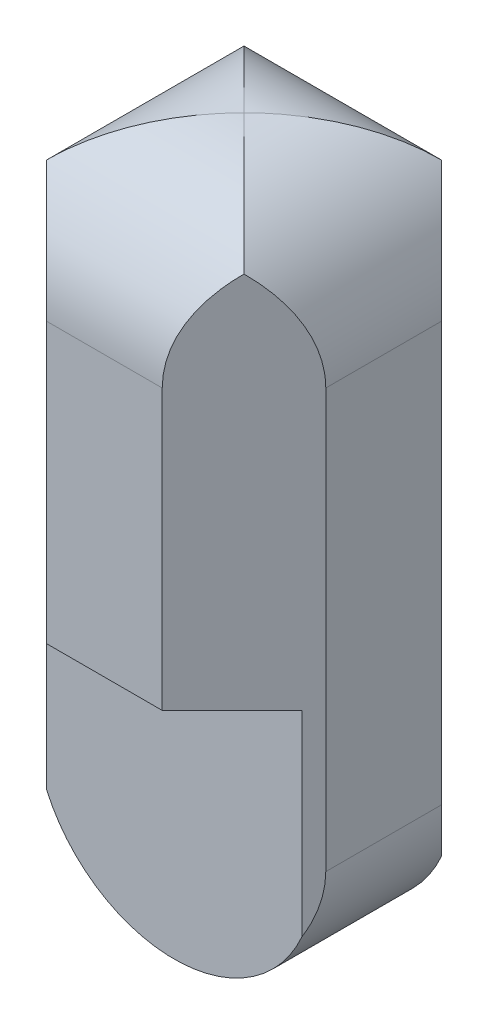
from build123d import *

# Parameters (mm, degrees)
EXTRUDE_1_DEPTH     = 50
CUT_EXTRUDE_1_DEPTH = 66
CUT_EXTRUDE_2_DEPTH = 5
CUT_EXTRUDE_START   = -5
CUT_EXTRUDE_3_DEPTH = 5
CUT_EXTRUDE_5_DEPTH = 30
CUT_EXTRUDE_6_DEPTH = 30


with BuildPart() as part:
    # 草图1 → 凸台-拉伸1 (new body)
    with BuildSketch(Plane(origin=(0, 0, 0), x_dir=(1, 0, 0), z_dir=(0, 1, 0))):
        Polygon((10, 4.142135624), (4.142135624, 10), (-4.142135624, 10), (-10, 4.142135624), (-10, -4.142135624), (-4.142135624, -10), (4.142135624, -10), (10, -4.142135624), align=None)
    extrude(amount=EXTRUDE_1_DEPTH)

    # 草图2 → 切除-拉伸1 (cut)
    with BuildSketch(Plane.XY.offset(10)):
        with BuildLine():
            Line((-10, 10), (-10, -2.389295552))
            Line((-10, -2.389295552), (10, -2.389295552))
            Line((10, -2.389295552), (10, 10))
            ThreePointArc((10, 10), (0, 0), (-10, 10))
        make_face()
    extrude(amount=-CUT_EXTRUDE_1_DEPTH, mode=Mode.SUBTRACT)

    # 草图4 → 切除-拉伸2 (cut)
    with BuildSketch(Plane.XY.offset(10)):
        with BuildLine():
            Line((-10, 10), (-10, 20))
            Line((-10, 20), (10, 20))
            Line((10, 20), (10, 10))
            ThreePointArc((10, 10), (0, 0), (-10, 10))
        make_face()
    extrude(amount=-CUT_EXTRUDE_2_DEPTH, mode=Mode.SUBTRACT)

    # 草图5 → 切除-拉伸3 (cut)
    with BuildSketch(Plane(origin=(0, 0, -10), x_dir=(-1, 0, 0), z_dir=(0, 0, -1)).offset(CUT_EXTRUDE_START)):
        with BuildLine():
            Line((-10, 10), (-10, 20))
            Line((-10, 20), (10, 20))
            Line((10, 20), (10, 10))
            ThreePointArc((10, 10), (0, 0), (-10, 10))
        make_face()
    extrude(amount=CUT_EXTRUDE_3_DEPTH, mode=Mode.SUBTRACT)

    # 草图7 → 切除-拉伸5 (cut)
    with BuildSketch(Plane.XY.offset(10)):
        with BuildLine():
            Line((-10, 40), (-10, 52.610016676))
            Line((-10, 52.610016676), (10, 52.610016676))
            Line((10, 52.610016676), (10, 40))
            ThreePointArc((10, 40), (0, 50), (-10, 40))
        make_face()
    extrude(amount=-CUT_EXTRUDE_5_DEPTH, mode=Mode.SUBTRACT)

    # 草图8 → 切除-拉伸6 (cut)
    with BuildSketch(Plane(origin=(10, 0, 0), x_dir=(0, 0, -1), z_dir=(1, 0, 0))):
        with BuildLine():
            Line((-10, 40), (-10, 54.562321687))
            Line((-10, 54.562321687), (10, 54.562321687))
            Line((10, 54.562321687), (10, 40))
            ThreePointArc((10, 40), (0, 50), (-10, 40))
        make_face()
    extrude(amount=-CUT_EXTRUDE_6_DEPTH, mode=Mode.SUBTRACT)


solid = part.part
